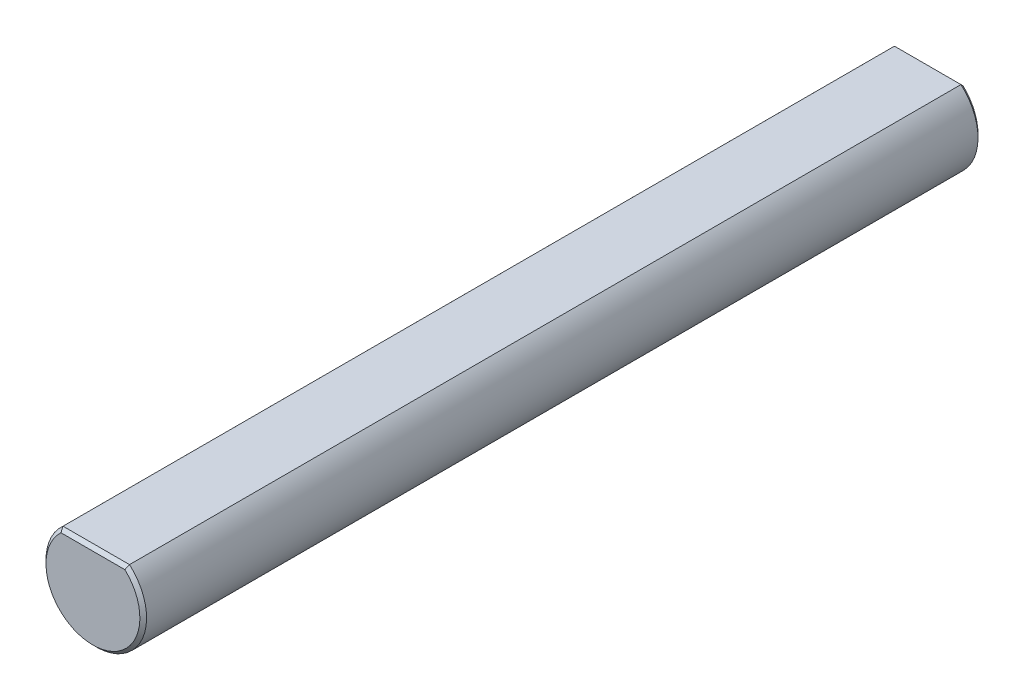
from build123d import *

# Parameters (mm, degrees)
EXTRUDE_1_DEPTH = 50
CHAMFER_1_SIZE  = 0.2


with BuildPart() as part:
    # 草圖1 → 填料-伸長1 (new body)
    with BuildSketch(Plane.XY.offset(52)):
        with BuildLine():
            Line((1.984313483, 2.25), (-1.984313483, 2.25))
            ThreePointArc((-1.984313483, 2.25), (0, -3), (1.984313483, 2.25))
        make_face()
    extrude(amount=-EXTRUDE_1_DEPTH)

    # 導角1
    chamfer_1_edges = [part.edges().sort_by_distance(p)[0] for p in [
        (0, 2.25, 52),
        (0, -3, 52),
        (0, -3, 2),
        (0, 2.25, 2),
    ]]
    chamfer(chamfer_1_edges, length=CHAMFER_1_SIZE)


solid = part.part
